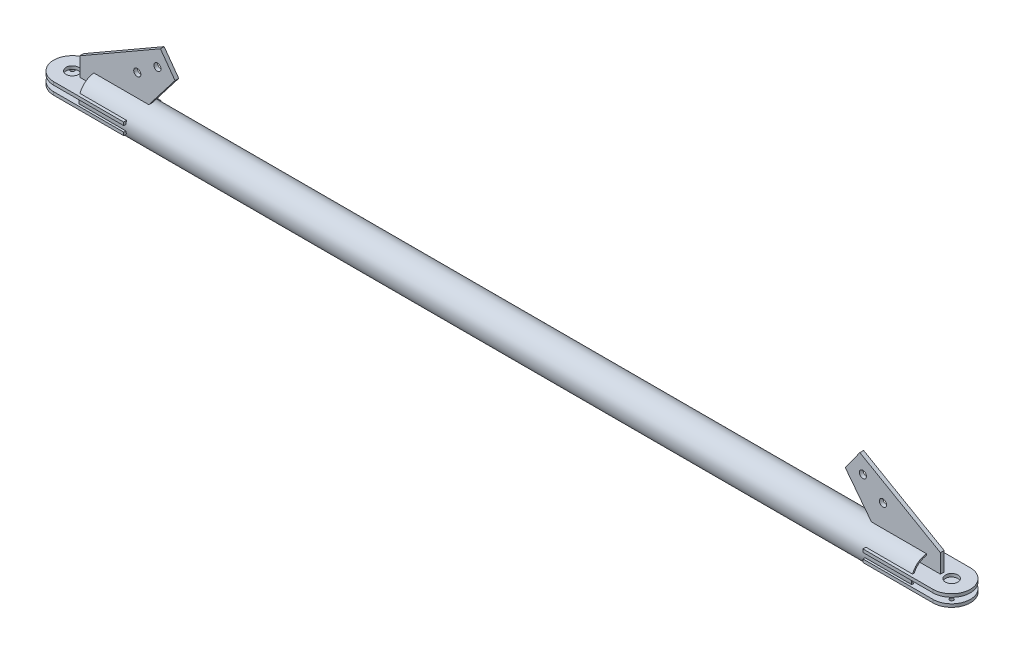
from build123d import *

# Parameters (mm, degrees)
SKETCH_1_R          = 54
SKETCH_1_R_2        = 49
EXTRUDE_1_DEPTH     = 2676.031139248
SKETCH_2_W          = 285
SKETCH_2_H          = 10
EXTRUDE_2_DEPTH     = 120
EXTRUDE_2_2_DEPTH   = 120
CUT_EXTRUDE_1_DEPTH = 2678.698948393
CUT_EXTRUDE_2_DEPTH = 2678.698948393
SKETCH_5_R          = 20
CUT_EXTRUDE_3_DEPTH = 2678.698948393
SKETCH_8_R          = 6
CUT_EXTRUDE_4_DEPTH = 10
EXTRUDE_4_DEPTH     = 12
SKETCH_12_R         = 11.5
CUT_EXTRUDE_5_DEPTH = 2687.537298871


with BuildPart() as part:
    # 草图1 → 凸台-拉伸1 (new body)
    with BuildSketch(Plane(origin=(0, 0, 0), x_dir=(0, 0, -1), z_dir=(1, 0, 0))):
        Circle(SKETCH_1_R)
        Circle(SKETCH_1_R_2, mode=Mode.SUBTRACT)
    extrude(amount=EXTRUDE_1_DEPTH)



with BuildPart() as body_2:
    # 草图2 → 凸台-拉伸2 (new body)
    with BuildSketch(Plane.XY.offset(60)):
        with Locations((7.5, 14)):
            Rectangle(SKETCH_2_W, SKETCH_2_H)
    extrude_2 = extrude(amount=-EXTRUDE_2_DEPTH)


with BuildPart() as body_3:
    # 草图2 → Extrude 2 2 (new body)
    with BuildSketch(Plane.XY.offset(60)):
        with Locations((7.5, -14)):
            Rectangle(SKETCH_2_W, SKETCH_2_H)
    extrude_2_2 = extrude(amount=-EXTRUDE_2_2_DEPTH)


with BuildPart() as cut_extrude_1_tool:
    # 草图3 → 切除-拉伸1 (new, through all)
    with BuildSketch(Plane(origin=(0, 19, 0), x_dir=(1, 0, 0), z_dir=(0, 1, 0))):
        with BuildLine():
            Line((-135, 0), (-135, 60))
            Line((-135, 60), (-75, 60))
            ThreePointArc((-75, 60), (-117.426406871, 42.426406871), (-135, 0))
        make_face()
    cut_extrude_1 = extrude(amount=-CUT_EXTRUDE_1_DEPTH)


with BuildPart() as body_2_1:
    add(body_2.part)

    # 切除-拉伸1: cut by cut_extrude_1_tool
    add(cut_extrude_1_tool.part, mode=Mode.SUBTRACT)


with BuildPart() as body_3_1:
    add(body_3.part)

    # 切除-拉伸1: cut by cut_extrude_1_tool
    add(cut_extrude_1_tool.part, mode=Mode.SUBTRACT)


with BuildPart() as cut_extrude_2_tool:
    # 草图4 → 切除-拉伸2 (new, through all)
    with BuildSketch(Plane(origin=(0, 19, 0), x_dir=(1, 0, 0), z_dir=(0, 1, 0))):
        with BuildLine():
            Line((-135, 0), (-135, -60))
            Line((-135, -60), (-75, -60))
            ThreePointArc((-75, -60), (-117.426406871, -42.426406871), (-135, 0))
        make_face()
    cut_extrude_2 = extrude(amount=-CUT_EXTRUDE_2_DEPTH)


with BuildPart() as body_2_2:
    add(body_2_1.part)

    # 切除-拉伸2: cut by cut_extrude_2_tool
    add(cut_extrude_2_tool.part, mode=Mode.SUBTRACT)


with BuildPart() as body_3_2:
    add(body_3_1.part)

    # 切除-拉伸2: cut by cut_extrude_2_tool
    add(cut_extrude_2_tool.part, mode=Mode.SUBTRACT)


with BuildPart() as cut_extrude_3_tool:
    # 草图5 → 切除-拉伸3 (new, through all)
    with BuildSketch(Plane(origin=(0, 19, 0), x_dir=(1, 0, 0), z_dir=(0, 1, 0))):
        with Locations(Location((-75, 0, 0), (0, 0, 270))):
            Circle(SKETCH_5_R)
    cut_extrude_3 = extrude(amount=-CUT_EXTRUDE_3_DEPTH)


with BuildPart() as body_2_3:
    add(body_2_2.part)

    # 切除-拉伸3: cut by cut_extrude_3_tool
    add(cut_extrude_3_tool.part, mode=Mode.SUBTRACT)


with BuildPart() as body_3_3:
    add(body_3_2.part)

    # 切除-拉伸3: cut by cut_extrude_3_tool
    add(cut_extrude_3_tool.part, mode=Mode.SUBTRACT)

    # 草图8 → 切除-拉伸4 (cut)
    with BuildSketch(Plane.XZ.offset(19)):
        with Locations(Location((-105, 30, 0), (0, 0, 270))):
            Circle(SKETCH_8_R)
        with Locations(Location((-105, -30, 0), (0, 0, 270))):
            Circle(SKETCH_8_R)
    cut_extrude_4 = extrude(amount=-CUT_EXTRUDE_4_DEPTH, mode=Mode.SUBTRACT)


with BuildPart() as part_1:
    add(part.part)

    add(body_2_3.part)  # 凸台-拉伸4 merges body 2
    # 草图11 → 凸台-拉伸4 (add)
    with BuildSketch(Plane.XY.offset(-6)):
        Polygon((150, 19), (-45, 19), (-45, 79), (214, 228), (261, 163), align=None)
    extrude_4 = extrude(amount=EXTRUDE_4_DEPTH)

    # 草图12 → 切除-拉伸5 (cut, through all)
    with BuildSketch(Plane(origin=(0, 0, -6), x_dir=(-1, 0, 0), z_dir=(0, 0, -1))):
        with Locations((-204.344601324, 172.166558966)):
            Circle(SKETCH_12_R)
        with Locations((-139.729642057, 124.997638702)):
            Circle(SKETCH_12_R)
    cut_extrude_5 = extrude(amount=-CUT_EXTRUDE_5_DEPTH, mode=Mode.SUBTRACT)

    # 镜向2: 凸台-拉伸2, Extrude 2 2, 切除-拉伸1, 切除-拉伸2, 切除-拉伸3, 切除-拉伸4, 凸台-拉伸4, 切除-拉伸5 across plane
    add(extrude_2.mirror(Plane(origin=(1338.015569624, 0, 0), x_dir=(0, 0, 1), z_dir=(1, 0, 0))))
    add(extrude_2_2.mirror(Plane(origin=(1338.015569624, 0, 0), x_dir=(0, 0, 1), z_dir=(1, 0, 0))))
    add(cut_extrude_1.mirror(Plane(origin=(1338.015569624, 0, 0), x_dir=(0, 0, 1), z_dir=(1, 0, 0))), mode=Mode.SUBTRACT)
    add(cut_extrude_2.mirror(Plane(origin=(1338.015569624, 0, 0), x_dir=(0, 0, 1), z_dir=(1, 0, 0))), mode=Mode.SUBTRACT)
    add(cut_extrude_3.mirror(Plane(origin=(1338.015569624, 0, 0), x_dir=(0, 0, 1), z_dir=(1, 0, 0))), mode=Mode.SUBTRACT)
    add(cut_extrude_4.mirror(Plane(origin=(1338.015569624, 0, 0), x_dir=(0, 0, 1), z_dir=(1, 0, 0))), mode=Mode.SUBTRACT)
    add(extrude_4.mirror(Plane(origin=(1338.015569624, 0, 0), x_dir=(0, 0, 1), z_dir=(1, 0, 0))))
    add(cut_extrude_5.mirror(Plane(origin=(1338.015569624, 0, 0), x_dir=(0, 0, 1), z_dir=(1, 0, 0))), mode=Mode.SUBTRACT)


solid = Compound([body_3_3.part, part_1.part])
